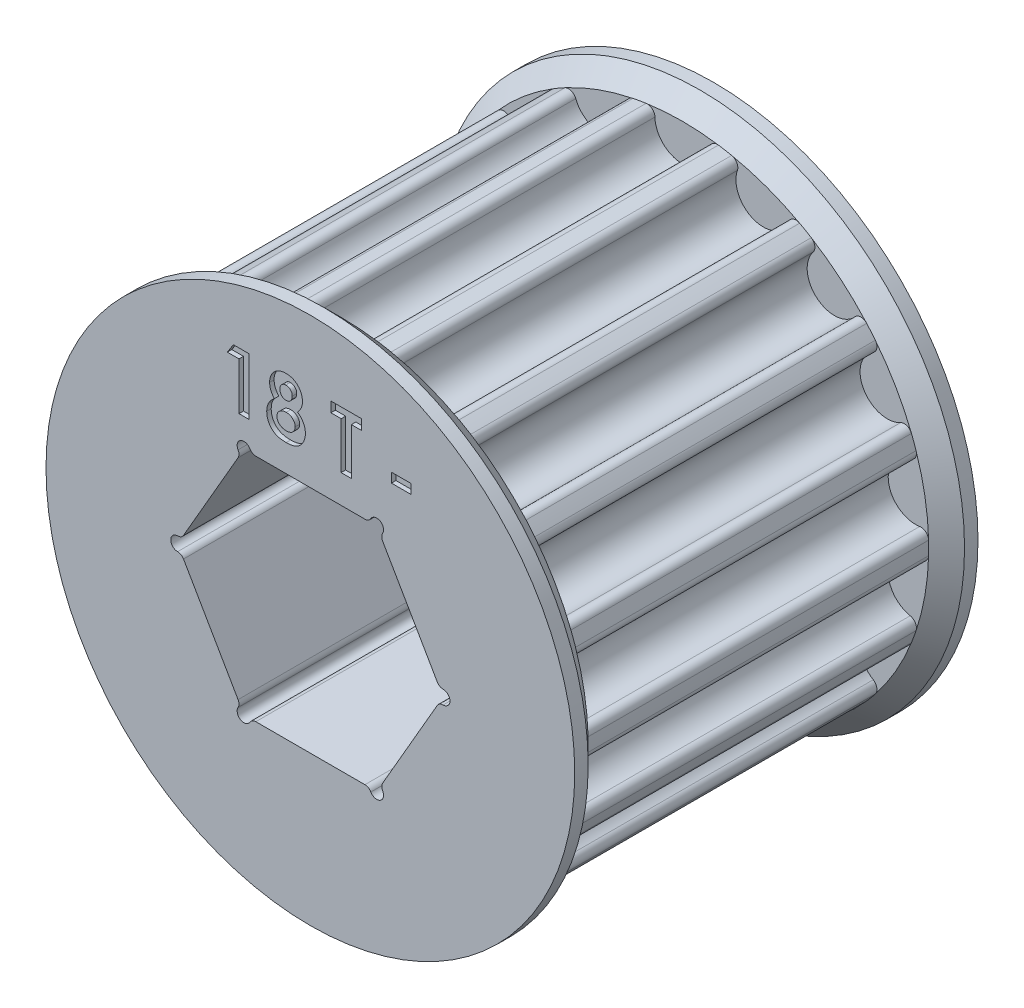
from build123d import *

# Parameters (mm, degrees)
SALIENTE_EXTRUIR1_DEPTH   = 9.5
CROQUIS5_R                = 13.75
SALIENTE_EXTRUIR2_DEPTH   = 1
SALIENTE_EXTRUIR2_DRAFT   = -45
CROQUIS7_R                = 14.75
SALIENTE_EXTRUIR3_DEPTH   = 0.75
SIMETR_A1_COPY_1_SKETCH_R = 13.75
SIMETR_A1_COPY_1_DEPTH    = 1
SIMETR_A1_COPY_1_DRAFT    = -45
CORTAR_EXTRUIR1_DEPTH     = 31.681835017
REDONDEO1_R               = 0.381
CORTAR_EXTRUIR3_START     = 11.25
CROQUIS9_W                = 1.099038462
CROQUIS9_H                = 0.529166666
CORTAR_EXTRUIR3_DEPTH     = 0.25


with BuildPart() as part:
    # Croquis3 → Saliente-Extruir1 (new, symmetric)
    with BuildSketch(Plane.XY):
        with BuildLine():
            ThreePointArc((0, 11.69), (1.067474312, 12.125906986), (1.524693529, 13.184428075))
            ThreePointArc((1.524693529, 13.184428075), (1.677022702, 13.504208303), (2.017706293, 13.601152941))
            ThreePointArc((2.017706293, 13.601152941), (2.387662443, 13.541106604), (2.755844564, 13.470999248))
            ThreePointArc((2.755844564, 13.470999248), (3.042825401, 13.263380437), (3.076596722, 12.91078567))
            ThreePointArc((3.076596722, 12.91078567), (3.144206711, 11.759723032), (3.998215475, 10.985006737))
            ThreePointArc((3.998215475, 10.985006737), (5.150402179, 11.029527598), (5.942083238, 11.867833872))
            ThreePointArc((5.942083238, 11.867833872), (6.194597118, 12.116229347), (6.547891992, 12.090806857))
            ThreePointArc((6.547891992, 12.090806857), (6.875, 11.907849302), (7.196999894, 11.716044235))
            ThreePointArc((7.196999894, 11.716044235), (7.395663854, 11.422793144), (7.306804002, 11.079911971))
            ThreePointArc((7.306804002, 11.079911971), (6.976650002, 9.975142926), (7.514187157, 8.95505954))
            ThreePointArc((7.514187157, 8.95505954), (8.612115532, 8.602824403), (9.642770013, 9.119803753))
            ThreePointArc((9.642770013, 9.119803753), (9.965011698, 9.266854315), (10.288305281, 9.122131025))
            ThreePointArc((10.288305281, 9.122131025), (10.533111093, 8.838329633), (10.770090821, 8.547961377))
            ThreePointArc((10.770090821, 8.547961377), (10.856476097, 8.204448415), (10.655702883, 7.912637366))
            ThreePointArc((10.655702883, 7.912637366), (9.967606338, 6.987413365), (10.12383697, 5.845))
            ThreePointArc((10.12383697, 5.845), (11.03508065, 5.138493621), (12.180396412, 5.271790708))
            ThreePointArc((12.180396412, 5.271790708), (12.5334988, 5.299759889), (12.787797114, 5.053191563))
            ThreePointArc((12.787797114, 5.053191563), (12.920773536, 4.702776971), (13.044149845, 4.348868223))
            ThreePointArc((13.044149845, 4.348868223), (13.007837099, 3.996526122), (12.719366734, 3.790981917))
            ThreePointArc((12.719366734, 3.790981917), (11.756322243, 3.156898629), (11.512402633, 2.029947197))
            ThreePointArc((11.512402633, 2.029947197), (12.127052181, 1.054384672), (13.24888724, 0.7879219))
            ThreePointArc((13.24888724, 0.7879219), (13.590260971, 0.693436203), (13.744891887, 0.374762622))
            ThreePointArc((13.744891887, 0.374762622), (13.75, 0), (13.744891887, -0.374762622))
            ThreePointArc((13.744891887, -0.374762622), (13.590260971, -0.693436203), (13.24888724, -0.7879219))
            ThreePointArc((13.24888724, -0.7879219), (12.127052181, -1.054384672), (11.512402633, -2.029947197))
            ThreePointArc((11.512402633, -2.029947197), (11.756322243, -3.156898629), (12.719366734, -3.790981917))
            ThreePointArc((12.719366734, -3.790981917), (13.007837099, -3.996526122), (13.044149845, -4.348868223))
            ThreePointArc((13.044149845, -4.348868223), (12.920773536, -4.702776971), (12.787797114, -5.053191563))
            ThreePointArc((12.787797114, -5.053191563), (12.5334988, -5.299759889), (12.180396412, -5.271790708))
            ThreePointArc((12.180396412, -5.271790708), (11.03508065, -5.138493621), (10.12383697, -5.845))
            ThreePointArc((10.12383697, -5.845), (9.967606338, -6.987413365), (10.655702883, -7.912637366))
            ThreePointArc((10.655702883, -7.912637366), (10.856476097, -8.204448415), (10.770090821, -8.547961377))
            ThreePointArc((10.770090821, -8.547961377), (10.533111093, -8.838329633), (10.288305281, -9.122131025))
            ThreePointArc((10.288305281, -9.122131025), (9.965011698, -9.266854315), (9.642770013, -9.119803753))
            ThreePointArc((9.642770013, -9.119803753), (8.612115532, -8.602824403), (7.514187157, -8.95505954))
            ThreePointArc((7.514187157, -8.95505954), (6.976650002, -9.975142926), (7.306804002, -11.079911971))
            ThreePointArc((7.306804002, -11.079911971), (7.395663854, -11.422793144), (7.196999894, -11.716044235))
            ThreePointArc((7.196999894, -11.716044235), (6.875, -11.907849302), (6.547891992, -12.090806857))
            ThreePointArc((6.547891992, -12.090806857), (6.194597118, -12.116229347), (5.942083238, -11.867833872))
            ThreePointArc((5.942083238, -11.867833872), (5.150402179, -11.029527598), (3.998215475, -10.985006737))
            ThreePointArc((3.998215475, -10.985006737), (3.144206711, -11.759723032), (3.076596722, -12.91078567))
            ThreePointArc((3.076596722, -12.91078567), (3.042825401, -13.263380437), (2.755844564, -13.470999248))
            ThreePointArc((2.755844564, -13.470999248), (2.387662443, -13.541106604), (2.017706293, -13.601152941))
            ThreePointArc((2.017706293, -13.601152941), (1.677022702, -13.504208303), (1.524693529, -13.184428075))
            ThreePointArc((1.524693529, -13.184428075), (1.067474312, -12.125906986), (0, -11.69))
            ThreePointArc((0, -11.69), (-1.067474312, -12.125906986), (-1.524693529, -13.184428075))
            ThreePointArc((-1.524693529, -13.184428075), (-1.677022702, -13.504208303), (-2.017706293, -13.601152941))
            ThreePointArc((-2.017706293, -13.601152941), (-2.387662443, -13.541106604), (-2.755844564, -13.470999248))
            ThreePointArc((-2.755844564, -13.470999248), (-3.042825401, -13.263380437), (-3.076596722, -12.91078567))
            ThreePointArc((-3.076596722, -12.91078567), (-3.144206711, -11.759723032), (-3.998215475, -10.985006737))
            ThreePointArc((-3.998215475, -10.985006737), (-5.150402179, -11.029527598), (-5.942083238, -11.867833872))
            ThreePointArc((-5.942083238, -11.867833872), (-6.194597118, -12.116229347), (-6.547891992, -12.090806857))
            ThreePointArc((-6.547891992, -12.090806857), (-6.875, -11.907849302), (-7.196999894, -11.716044235))
            ThreePointArc((-7.196999894, -11.716044235), (-7.395663854, -11.422793144), (-7.306804002, -11.079911971))
            ThreePointArc((-7.306804002, -11.079911971), (-6.976650002, -9.975142926), (-7.514187157, -8.95505954))
            ThreePointArc((-7.514187157, -8.95505954), (-8.612115532, -8.602824403), (-9.642770013, -9.119803753))
            ThreePointArc((-9.642770013, -9.119803753), (-9.965011698, -9.266854315), (-10.288305281, -9.122131025))
            ThreePointArc((-10.288305281, -9.122131025), (-10.533111093, -8.838329633), (-10.770090821, -8.547961377))
            ThreePointArc((-10.770090821, -8.547961377), (-10.856476097, -8.204448415), (-10.655702883, -7.912637366))
            ThreePointArc((-10.655702883, -7.912637366), (-9.967606338, -6.987413365), (-10.12383697, -5.845))
            ThreePointArc((-10.12383697, -5.845), (-11.03508065, -5.138493621), (-12.180396412, -5.271790708))
            ThreePointArc((-12.180396412, -5.271790708), (-12.5334988, -5.299759889), (-12.787797114, -5.053191563))
            ThreePointArc((-12.787797114, -5.053191563), (-12.920773536, -4.702776971), (-13.044149845, -4.348868223))
            ThreePointArc((-13.044149845, -4.348868223), (-13.007837099, -3.996526122), (-12.719366734, -3.790981917))
            ThreePointArc((-12.719366734, -3.790981917), (-11.756322243, -3.156898629), (-11.512402633, -2.029947197))
            ThreePointArc((-11.512402633, -2.029947197), (-12.127052181, -1.054384672), (-13.24888724, -0.7879219))
            ThreePointArc((-13.24888724, -0.7879219), (-13.590260971, -0.693436203), (-13.744891887, -0.374762622))
            ThreePointArc((-13.744891887, -0.374762622), (-13.75, 0), (-13.744891887, 0.374762622))
            ThreePointArc((-13.744891887, 0.374762622), (-13.590260971, 0.693436203), (-13.24888724, 0.7879219))
            ThreePointArc((-13.24888724, 0.7879219), (-12.127052181, 1.054384672), (-11.512402633, 2.029947197))
            ThreePointArc((-11.512402633, 2.029947197), (-11.756322243, 3.156898629), (-12.719366734, 3.790981917))
            ThreePointArc((-12.719366734, 3.790981917), (-13.007837099, 3.996526122), (-13.044149845, 4.348868223))
            ThreePointArc((-13.044149845, 4.348868223), (-12.920773536, 4.702776971), (-12.787797114, 5.053191563))
            ThreePointArc((-12.787797114, 5.053191563), (-12.5334988, 5.299759889), (-12.180396412, 5.271790708))
            ThreePointArc((-12.180396412, 5.271790708), (-11.03508065, 5.138493621), (-10.12383697, 5.845))
            ThreePointArc((-10.12383697, 5.845), (-9.967606338, 6.987413365), (-10.655702883, 7.912637366))
            ThreePointArc((-10.655702883, 7.912637366), (-10.856476097, 8.204448415), (-10.770090821, 8.547961377))
            ThreePointArc((-10.770090821, 8.547961377), (-10.533111093, 8.838329633), (-10.288305281, 9.122131025))
            ThreePointArc((-10.288305281, 9.122131025), (-9.965011698, 9.266854315), (-9.642770013, 9.119803753))
            ThreePointArc((-9.642770013, 9.119803753), (-8.612115532, 8.602824403), (-7.514187157, 8.95505954))
            ThreePointArc((-7.514187157, 8.95505954), (-6.976650002, 9.975142926), (-7.306804002, 11.079911971))
            ThreePointArc((-7.306804002, 11.079911971), (-7.395663854, 11.422793144), (-7.196999894, 11.716044235))
            ThreePointArc((-7.196999894, 11.716044235), (-6.875, 11.907849302), (-6.547891992, 12.090806857))
            ThreePointArc((-6.547891992, 12.090806857), (-6.194597118, 12.116229347), (-5.942083238, 11.867833872))
            ThreePointArc((-5.942083238, 11.867833872), (-5.150402179, 11.029527598), (-3.998215475, 10.985006737))
            ThreePointArc((-3.998215475, 10.985006737), (-3.144206711, 11.759723032), (-3.076596722, 12.91078567))
            ThreePointArc((-3.076596722, 12.91078567), (-3.042825401, 13.263380437), (-2.755844564, 13.470999248))
            ThreePointArc((-2.755844564, 13.470999248), (-2.387662443, 13.541106604), (-2.017706293, 13.601152941))
            ThreePointArc((-2.017706293, 13.601152941), (-1.677022702, 13.504208303), (-1.524693529, 13.184428075))
            ThreePointArc((-1.524693529, 13.184428075), (-1.067474312, 12.125906986), (0, 11.69))
        make_face()
    extrude(amount=SALIENTE_EXTRUIR1_DEPTH, both=True)


with BuildPart() as saliente_extruir2_tool:
    # Croquis5 → Saliente-Extruir2 (with draft: the straight prism first)
    with BuildSketch(Plane.XY.offset(9.5)):
        Circle(CROQUIS5_R)
    extrude(amount=SALIENTE_EXTRUIR2_DEPTH)
    # Saliente-Extruir2: the draft: its side faces are tilted about the plane it starts from
    saliente_extruir2_sides = [saliente_extruir2_tool.faces().sort_by_distance(p)[0] for p in [
        (-13.75, 0, 10),
    ]]
    draft(saliente_extruir2_sides, Plane.XY.offset(9.5), SALIENTE_EXTRUIR2_DRAFT)


with BuildPart() as part_1:
    add(part.part)

    # Saliente-Extruir2: add saliente_extruir2_tool
    add(saliente_extruir2_tool.part)

    # Croquis7 → Saliente-Extruir3 (add)
    with BuildSketch(Plane.XY.offset(10.5)):
        Circle(CROQUIS7_R)
    saliente_extruir3 = extrude(amount=SALIENTE_EXTRUIR3_DEPTH)


with BuildPart() as simetr_a1_1:
    # Simetría1: Saliente-Extruir3 across plane
    add(saliente_extruir3.mirror(Plane.XY))


with BuildPart() as simetr_a1_copy_1_tool:
    # Simetría1 copy 1 sketch → Simetría1 copy 1 (with draft: the straight prism first)
    with BuildSketch(Plane(origin=(0, 0, -9.5), x_dir=(1, 0, 0), z_dir=(0, 0, -1))):
        Circle(SIMETR_A1_COPY_1_SKETCH_R)
    extrude(amount=SIMETR_A1_COPY_1_DEPTH)
    # Simetría1 copy 1: the draft: its side faces are tilted about the plane it starts from
    simetr_a1_copy_1_sides = [simetr_a1_copy_1_tool.faces().sort_by_distance(p)[0] for p in [
        (-13.75, 0, -10),
    ]]
    draft(simetr_a1_copy_1_sides, Plane(origin=(0, 0, -9.5), x_dir=(1, 0, 0), z_dir=(0, 0, -1)), SIMETR_A1_COPY_1_DRAFT)


with BuildPart() as part_2:
    add(part_1.part)

    # Simetría1 copy 1: add simetr_a1_copy_1_tool
    add(simetr_a1_copy_1_tool.part)

    add(simetr_a1_1.part)  # Simetría1 copy 1 merges Simetría1_1

    # Croquis6 → Cortar-Extruir1 (cut, through all)
    with BuildSketch(Plane.XY.offset(11.25)):
        Polygon((-7.407403954, 0), (-3.703701977, -6.415), (3.703701977, -6.415), (7.407403954, 0), (3.703701977, 6.415), (-3.703701977, 6.415), align=None)
        with BuildLine():
            Line((-3.703701977, 6.415), (-3.322701977, 6.415))
            ThreePointArc((-3.322701977, 6.415), (-3.894201977, 6.744955679), (-3.894201977, 6.085044321))
            Line((-3.894201977, 6.085044321), (-3.703701977, 6.415))
        make_face()
        with BuildLine():
            Line((3.703701977, 6.415), (3.894201977, 6.085044321))
            ThreePointArc((3.894201977, 6.085044321), (3.894201977, 6.744955679), (3.322701977, 6.415))
            Line((3.322701977, 6.415), (3.703701977, 6.415))
        make_face()
        with BuildLine():
            Line((7.407403954, 0), (7.216903954, -0.329955679))
            ThreePointArc((7.216903954, -0.329955679), (7.788403954, 0), (7.216903954, 0.329955679))
            Line((7.216903954, 0.329955679), (7.407403954, 0))
        make_face()
        with BuildLine():
            Line((3.894201977, -6.085044321), (3.703701977, -6.415))
            Line((3.703701977, -6.415), (3.322701977, -6.415))
            ThreePointArc((3.322701977, -6.415), (3.894201977, -6.744955679), (3.894201977, -6.085044321))
        make_face()
        with BuildLine():
            ThreePointArc((-3.894201977, -6.085044321), (-3.894201977, -6.744955679), (-3.322701977, -6.415))
            Line((-3.322701977, -6.415), (-3.703701977, -6.415))
            Line((-3.703701977, -6.415), (-3.894201977, -6.085044321))
        make_face()
        with BuildLine():
            ThreePointArc((-7.216903954, 0.329955679), (-7.788403954, 0), (-7.216903954, -0.329955679))
            Line((-7.216903954, -0.329955679), (-7.407403954, 0))
            Line((-7.407403954, 0), (-7.216903954, 0.329955679))
        make_face()
    extrude(amount=-CORTAR_EXTRUIR1_DEPTH, mode=Mode.SUBTRACT)

    # Redondeo1
    redondeo1_edges = [part_2.edges().sort_by_distance(p)[0] for p in [
        (-7.216903954, -0.329955679, 0),
        (-7.216903954, 0.329955679, 0),
        (-3.894201977, 6.085044321, 0),
        (-3.322701977, 6.415, 0),
        (3.322701977, 6.415, 0),
        (3.894201977, 6.085044321, 0),
        (7.216903954, 0.329955679, 0),
        (7.216903954, -0.329955679, 0),
        (3.894201977, -6.085044321, 0),
        (3.322701977, -6.415, 0),
        (-3.322701977, -6.415, 0),
        (-3.894201977, -6.085044321, 0),
    ]]
    fillet(redondeo1_edges, radius=REDONDEO1_R)

    # Croquis9 → Cortar-Extruir3 (cut)
    # profile 1 of 4: a face of its own
    with BuildSketch(Plane.XY.offset(CORTAR_EXTRUIR3_START)):
        Polygon((-4.293384415, 11.175), (-3.4125, 11.175), (-3.4125, 8), (-3.982371795, 8), (-3.982371795, 10.645833333), (-4.633653846, 10.645833333), align=None)
    # profile 2 of 4: a face of its own
    with BuildSketch(Plane.XY.offset(CORTAR_EXTRUIR3_START)):
        with BuildLine():
            add(Edge.make_bspline(
                [(-0.713241186, 9.709615385), (-0.679947312, 9.685826012), (-0.614045092, 9.638737096), (-0.527012367, 9.554375541), (-0.452046847, 9.460269248), (-0.389935755, 9.356995446), (-0.340174221, 9.247092633), (-0.304552512, 9.131735537), (-0.281926012, 9.011941637), (-0.279454523, 8.930382608), (-0.278205128, 8.889152644)],
                knots=[0, 0, 0, 0, 1.013736912, 2.006600758, 2.994453809, 3.989973287, 4.987781207, 5.978959008, 6.978317308, 8, 8, 8, 8], degree=3))
            add(Edge.make_bspline(
                [(-0.278205128, 8.889152644), (-0.279712428, 8.84450785), (-0.282701963, 8.755960631), (-0.309133449, 8.626106148), (-0.35156814, 8.50135344), (-0.409563425, 8.383079461), (-0.482278847, 8.274959714), (-0.567035434, 8.179242926), (-0.663940029, 8.098428905), (-0.754160951, 8.043597114), (-0.831817251, 8.007173392), (-0.894485203, 7.983862941), (-0.960658442, 7.96334135), (-1.030809169, 7.946945961), (-1.104924629, 7.934146669), (-1.18289905, 7.92569404), (-1.264783761, 7.919549495), (-1.320625672, 7.918915055), (-1.349258814, 7.918589744)],
                knots=[0, 0, 0, 0, 1.313679292, 2.605514271, 3.884962679, 5.186178731, 6.472827995, 7.711026938, 8.938935107, 10.174644318, 10.808706728, 11.462743532, 12.142127587, 12.847854939, 13.582806024, 14.355735269, 15.156897313, 16, 16, 16, 16], degree=3))
            add(Edge.make_bspline(
                [(-1.349258814, 7.918589744), (-1.379793219, 7.91900393), (-1.439420892, 7.919812753), (-1.526464012, 7.924703329), (-1.608571389, 7.933719654), (-1.685915257, 7.945588948), (-1.758421202, 7.961295464), (-1.826091372, 7.981210467), (-1.889089165, 8.003885913), (-1.966201773, 8.038411225), (-2.0543275, 8.092329893), (-2.149575474, 8.171292228), (-2.233178826, 8.265338836), (-2.305864023, 8.371829843), (-2.363157235, 8.490110116), (-2.405762175, 8.616467223), (-2.430993325, 8.750558751), (-2.434030873, 8.842404855), (-2.435576923, 8.889152644)],
                knots=[0, 0, 0, 0, 0.886964665, 1.7320671, 2.531131818, 3.285397207, 4.004107883, 4.684213108, 5.332925796, 5.947568694, 7.135706876, 8.320776993, 9.52873045, 10.778999824, 12.05415135, 13.333578234, 14.642845846, 16, 16, 16, 16], degree=3))
            add(Edge.make_bspline(
                [(-2.435576923, 8.889152644), (-2.434164093, 8.9299324), (-2.431387709, 9.010069557), (-2.411500102, 9.127495836), (-2.377398898, 9.238829844), (-2.330606738, 9.344846641), (-2.270269043, 9.445558024), (-2.19602901, 9.540222955), (-2.108827928, 9.629695445), (-2.042701718, 9.682533521), (-2.008809095, 9.709615385)],
                knots=[0, 0, 0, 0, 1.01821053, 2.000906977, 2.963938143, 3.919209931, 4.888045165, 5.887808425, 6.917407893, 8, 8, 8, 8], degree=3))
            add(Edge.make_bspline(
                [(-2.008809095, 9.709615385), (-2.029820723, 9.733849224), (-2.071186292, 9.781558356), (-2.124713745, 9.858342401), (-2.16980837, 9.937506832), (-2.208095854, 10.018409188), (-2.236398938, 10.102442406), (-2.257802594, 10.18828531), (-2.269908481, 10.276812445), (-2.271800668, 10.336482365), (-2.27275641, 10.366621595)],
                knots=[0, 0, 0, 0, 1.061529281, 2.089831458, 3.092927091, 4.075998741, 5.048384512, 6.024008542, 7.00192825, 8, 8, 8, 8], degree=3))
            add(Edge.make_bspline(
                [(-2.27275641, 10.366621595), (-2.271489242, 10.407421227), (-2.268989167, 10.487917329), (-2.24684615, 10.605621637), (-2.210083365, 10.717464189), (-2.160070726, 10.823117526), (-2.096562446, 10.920279049), (-2.02110086, 11.007411214), (-1.932625126, 11.081322406), (-1.834425421, 11.14474147), (-1.726009519, 11.195184406), (-1.60840606, 11.230480594), (-1.483035123, 11.252824943), (-1.396633216, 11.255196971), (-1.352438902, 11.256410256)],
                knots=[0, 0, 0, 0, 1.022455555, 2.017265428, 2.990720743, 3.968117071, 4.939886797, 5.893155559, 6.847550415, 7.820889576, 8.817530429, 9.83499769, 10.892607882, 12, 12, 12, 12], degree=3))
            add(Edge.make_bspline(
                [(-1.352438902, 11.256410256), (-1.308881102, 11.255194985), (-1.223952512, 11.252825462), (-1.100784802, 11.230629167), (-0.985722777, 11.194546749), (-0.879717915, 11.143038738), (-0.782533785, 11.079497441), (-0.695561764, 11.003012731), (-0.620336979, 10.913710397), (-0.55630154, 10.814035335), (-0.505275135, 10.706649897), (-0.467551494, 10.594033972), (-0.445731695, 10.477072732), (-0.442600599, 10.397661569), (-0.441025641, 10.357717348)],
                knots=[0, 0, 0, 0, 1.094655142, 2.134348324, 3.136019022, 4.118575226, 5.088726318, 6.048298823, 7.020513804, 8.015920439, 9.020015034, 10.003048569, 10.995523219, 12, 12, 12, 12], degree=3))
            add(Edge.make_bspline(
                [(-0.441025641, 10.357717348), (-0.441784336, 10.329486932), (-0.443273218, 10.274086853), (-0.454281711, 10.192466901), (-0.472818663, 10.114152447), (-0.49866337, 10.037250953), (-0.534596336, 9.959672577), (-0.583221994, 9.879930777), (-0.642368721, 9.794712264), (-0.688819601, 9.738938489), (-0.713241186, 9.709615385)],
                knots=[0, 0, 0, 0, 0.940746401, 1.846144481, 2.739104268, 3.619506754, 4.545839139, 5.581956076, 6.728711598, 8, 8, 8, 8], degree=3))
        make_face()
        with BuildLine():
            add(Edge.make_bspline(
                [(-1.36643129, 10.686538462), (-1.389894102, 10.685407337), (-1.435534455, 10.683207049), (-1.500657894, 10.663347019), (-1.559205991, 10.630864527), (-1.609842269, 10.586162225), (-1.651366657, 10.531922679), (-1.6818848, 10.469563237), (-1.69998242, 10.399853484), (-1.701898405, 10.351041394), (-1.702884615, 10.325916466)],
                knots=[0, 0, 0, 0, 1.018099191, 1.980427864, 2.929421084, 3.909248076, 4.895556904, 5.880788387, 6.909183412, 8, 8, 8, 8], degree=3))
            add(Edge.make_bspline(
                [(-1.702884615, 10.325916466), (-1.701666344, 10.300576967), (-1.699287552, 10.251099152), (-1.680581026, 10.180050049), (-1.648695235, 10.115659356), (-1.60491626, 10.059271984), (-1.551717715, 10.013216409), (-1.492151654, 9.978041724), (-1.425557476, 9.957961409), (-1.379280914, 9.955238447), (-1.35561899, 9.953846154)],
                knots=[0, 0, 0, 0, 1.07118507, 2.091592095, 3.082435519, 4.092579768, 5.090825648, 6.043203473, 6.999459622, 8, 8, 8, 8], degree=3))
            add(Edge.make_bspline(
                [(-1.35561899, 9.953846154), (-1.331509726, 9.954924942), (-1.284540356, 9.957026624), (-1.217779902, 9.977627967), (-1.157637264, 10.010575617), (-1.106133981, 10.057156306), (-1.063473441, 10.113564099), (-1.032404754, 10.179080076), (-1.014522741, 10.252473276), (-1.012135429, 10.303768386), (-1.010897436, 10.33036859)],
                knots=[0, 0, 0, 0, 1.008803858, 1.965339183, 2.900766489, 3.864508618, 4.855158575, 5.849593072, 6.884859315, 8, 8, 8, 8], degree=3))
            add(Edge.make_bspline(
                [(-1.010897436, 10.33036859), (-1.012166745, 10.355476908), (-1.014621544, 10.404035512), (-1.032223395, 10.473749787), (-1.064550075, 10.535135947), (-1.107023161, 10.589038677), (-1.160273029, 10.632507876), (-1.222092225, 10.664475387), (-1.292025539, 10.683016853), (-1.341092285, 10.685339172), (-1.36643129, 10.686538462)],
                knots=[0, 0, 0, 0, 1.065910571, 2.061433587, 3.023559535, 3.990682701, 4.956464619, 5.918590567, 6.925120432, 8, 8, 8, 8], degree=3))
        make_face(mode=Mode.SUBTRACT)
        with BuildLine():
            add(Edge.make_bspline(
                [(-1.347986779, 9.383974359), (-1.36581674, 9.383678266), (-1.40095937, 9.38309467), (-1.452621924, 9.376364936), (-1.502197455, 9.366335968), (-1.549624454, 9.352501289), (-1.594663325, 9.333641141), (-1.637695848, 9.310904884), (-1.678573406, 9.284062683), (-1.716689673, 9.253601858), (-1.751137871, 9.220168201), (-1.782189789, 9.18529798), (-1.807570347, 9.148089706), (-1.828706301, 9.109780194), (-1.845689159, 9.070065862), (-1.856916112, 9.028292696), (-1.864144698, 8.985016998), (-1.865181925, 8.955539347), (-1.865705128, 8.940670072)],
                knots=[0, 0, 0, 0, 1.129580664, 2.226389355, 3.296443603, 4.333934503, 5.352185725, 6.386189251, 7.41493955, 8.447544828, 9.47401038, 10.455044306, 11.4018853, 12.322125673, 13.225630306, 14.132028716, 15.057747923, 16, 16, 16, 16], degree=3))
            add(Edge.make_bspline(
                [(-1.865705128, 8.940670072), (-1.86545576, 8.925162887), (-1.86496117, 8.894406304), (-1.857491073, 8.849514587), (-1.846735452, 8.806219609), (-1.83162884, 8.764926636), (-1.811426616, 8.725659711), (-1.787304794, 8.688037072), (-1.758422256, 8.652322538), (-1.725562142, 8.618707595), (-1.68877539, 8.588380917), (-1.649127334, 8.561662584), (-1.607141633, 8.538106335), (-1.561557906, 8.521140191), (-1.514064302, 8.505611286), (-1.463388451, 8.496190273), (-1.410083846, 8.48925803), (-1.373664711, 8.488731586), (-1.354982973, 8.488461538)],
                knots=[0, 0, 0, 0, 0.973817353, 1.931446211, 2.852767904, 3.776304432, 4.688323523, 5.623710549, 6.581246645, 7.570897993, 8.57436511, 9.572506873, 10.574556662, 11.591826551, 12.624694332, 13.712108235, 14.826391851, 16, 16, 16, 16], degree=3))
            add(Edge.make_bspline(
                [(-1.354982973, 8.488461538), (-1.336098515, 8.488803842), (-1.299298687, 8.489470882), (-1.24550474, 8.495366257), (-1.194625212, 8.504720502), (-1.146720878, 8.518099252), (-1.101610587, 8.535237963), (-1.059899453, 8.557052151), (-1.020635143, 8.581773696), (-0.985079419, 8.610655854), (-0.952614423, 8.642131378), (-0.92464127, 8.676625875), (-0.900856008, 8.713030128), (-0.881670603, 8.751737483), (-0.866189704, 8.792565228), (-0.855570778, 8.835920457), (-0.848981353, 8.881315958), (-0.848381636, 8.912238245), (-0.848076923, 8.92794972)],
                knots=[0, 0, 0, 0, 1.200705402, 2.339794563, 3.437264955, 4.487414319, 5.499029866, 6.500076882, 7.476298407, 8.444948224, 9.407950986, 10.347155707, 11.263432813, 12.167927724, 13.089546445, 14.03463663, 15.00140776, 16, 16, 16, 16], degree=3))
            add(Edge.make_bspline(
                [(-0.848076923, 8.92794972), (-0.848658746, 8.943866599), (-0.849796008, 8.974978582), (-0.856018937, 9.020922743), (-0.867692518, 9.064478525), (-0.882964972, 9.106656097), (-0.903280843, 9.146582665), (-0.928502557, 9.184173963), (-0.957211058, 9.220361173), (-0.990764953, 9.253533371), (-1.027450919, 9.283864551), (-1.066497283, 9.310886303), (-1.107783776, 9.333771234), (-1.151423332, 9.352478529), (-1.1975754, 9.366343167), (-1.245887836, 9.376364584), (-1.296281391, 9.383096176), (-1.330580213, 9.38367872), (-1.347986779, 9.383974359)],
                knots=[0, 0, 0, 0, 1.011708178, 1.977538892, 2.938094892, 3.871441737, 4.823268678, 5.775953079, 6.743660653, 7.753304209, 8.767430709, 9.76505158, 10.765940967, 11.761741361, 12.775867861, 13.822051386, 14.89469657, 16, 16, 16, 16], degree=3))
        make_face(mode=Mode.SUBTRACT)
    # profile 3 of 4: a face of its own
    with BuildSketch(Plane.XY.offset(CORTAR_EXTRUIR3_START)):
        Polygon((1.146474359, 11.175), (2.856089744, 11.175), (2.856089744, 10.605128205), (2.286217949, 10.605128205), (2.286217949, 8), (1.716346154, 8), (1.716346154, 10.605128205), (1.146474359, 10.605128205), align=None)
    # profile 4 of 4: a face of its own
    with BuildSketch(Plane.XY.offset(CORTAR_EXTRUIR3_START)):
        with Locations((5.074519231, 9.160096154)):
            Rectangle(CROQUIS9_W, CROQUIS9_H)
    extrude(amount=-CORTAR_EXTRUIR3_DEPTH, mode=Mode.SUBTRACT)


solid = part_2.part
